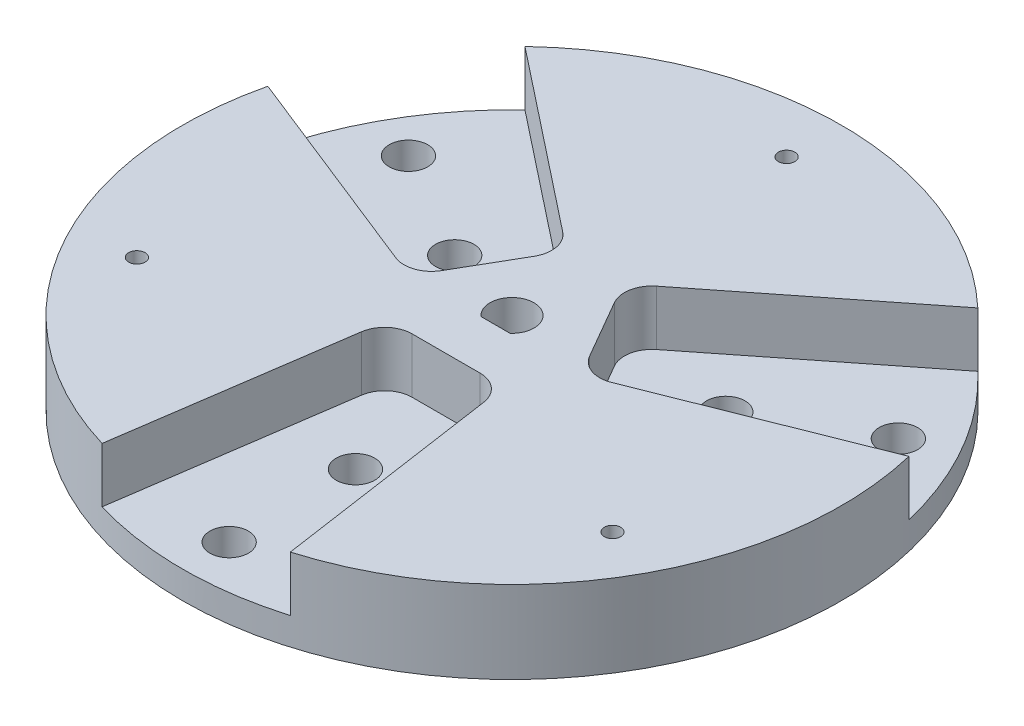
from build123d import *

# Parameters (mm, degrees)
SKETCH1_R           = 60
BOSS_EXTRUDE1_DEPTH = 15
CUT_EXTRUDE1_REACH  = 88.168
CUT_EXTRUDE2_DEPTH  = 10
CUT_EXTRUDE3_REACH  = 87.44
SKETCH3_R           = 3.5
CIRPATTERN1_COUNT   = 3
CIRPATTERN2_COUNT   = 3
FILLET1_R           = 5
CUT_EXTRUDE4_REACH  = 88.168
SKETCH4_R           = 1.5
CIRPATTERN3_COUNT   = 3
BOSS_EXTRUDE2_REACH = 88.168


with BuildPart() as part:
    # Sketch1 → Boss-Extrude1 (new body)
    with BuildSketch(Plane(origin=(0, 0, 0), x_dir=(1, 0, 0), z_dir=(0, 1, 0))):
        Circle(SKETCH1_R)
    extrude(amount=BOSS_EXTRUDE1_DEPTH)

    # Sketch2 → Cut-Extrude1 (cut, up to next)
    with BuildSketch(Plane(origin=(0, 15, 0), x_dir=(1, 0, 0), z_dir=(0, 1, 0)), mode=Mode.PRIVATE) as cut_extrude1_sk1:
        with BuildLine():
            ThreePointArc((2.645751311, -3), (0, 4), (-2.645751311, -3))
            Line((-2.645751311, -3), (2.645751311, -3))
        make_face()
    cut_extrude1_tool1 = extrude(cut_extrude1_sk1.sketch, amount=-CUT_EXTRUDE1_REACH, mode=Mode.PRIVATE) & part.part
    add(cut_extrude1_tool1.solids().sort_by_distance((0, 15, -0.264732))[0], mode=Mode.SUBTRACT)

    # Sketch2<3> → Cut-Extrude2 (cut)
    with BuildSketch(Plane(origin=(0, 15, 0), x_dir=(1, 0, 0), z_dir=(0, 1, 0))):
        with BuildLine():
            Line((-2.645751311, -3), (2.645751311, -3))
            ThreePointArc((2.645751311, -3), (0, 4), (-2.645751311, -3))
        make_face()
        Polygon((-17.5, -60), (17.5, -60), (10.5, -12), (-10.5, -12), align=None)
    cut_extrude2 = extrude(amount=-CUT_EXTRUDE2_DEPTH, mode=Mode.SUBTRACT)

    # Sketch3 → Cut-Extrude3 (cut, up to next)
    with BuildSketch(Plane(origin=(0, 5, 0), x_dir=(1, 0, 0), z_dir=(0, 1, 0)), mode=Mode.PRIVATE) as cut_extrude3_sk1:
        with Locations((0, -28.5)):
            Circle(SKETCH3_R)
    cut_extrude3_tool1 = extrude(cut_extrude3_sk1.sketch, amount=-CUT_EXTRUDE3_REACH, mode=Mode.PRIVATE) & part.part
    # Sketch3 → Cut-Extrude3 (cut, up to next)
    with BuildSketch(Plane(origin=(0, 5, 0), x_dir=(1, 0, 0), z_dir=(0, 1, 0)), mode=Mode.PRIVATE) as cut_extrude3_sk2:
        with Locations((0, -51.5)):
            Circle(SKETCH3_R)
    cut_extrude3_tool2 = extrude(cut_extrude3_sk2.sketch, amount=-CUT_EXTRUDE3_REACH, mode=Mode.PRIVATE) & part.part
    cut_extrude3_1 = cut_extrude3_tool1.solids().sort_by_distance((0, 5, 28.5))[0]
    add(cut_extrude3_1, mode=Mode.SUBTRACT)
    cut_extrude3_2 = cut_extrude3_tool2.solids().sort_by_distance((0, 5, 51.5))[0]
    add(cut_extrude3_2, mode=Mode.SUBTRACT)
    cut_extrude3 = cut_extrude3_1 + cut_extrude3_2  # Cut-Extrude3 as one shape, for the pattern or mirror that repeats it

    # CirPattern1: Cut-Extrude2 ×3 about axis
    cirpattern1_axis = Axis((0, -0.001, 0), (0, 1, 0))
    for i in range(1, CIRPATTERN1_COUNT):
        add(cut_extrude2.rotate(cirpattern1_axis, i * 360 / CIRPATTERN1_COUNT), mode=Mode.SUBTRACT)

    # CirPattern2: Cut-Extrude3 ×3 about axis
    cirpattern2_axis = Axis((0, 15, 0), (0, 1, 0))
    for i in range(1, CIRPATTERN2_COUNT):
        add(cut_extrude3.rotate(cirpattern2_axis, i * 360 / CIRPATTERN2_COUNT), mode=Mode.SUBTRACT)

    # Fillet1
    fillet1_edges = [part.edges().sort_by_distance(p)[0] for p in [
        (10.5, 10, 12),
        (-10.5, 10, 12),
        (-15.642304845, 10, 3.09326674),
        (-5.142304845, 10, -15.09326674),
        (15.642304845, 10, 3.09326674),
        (5.142304845, 10, -15.09326674),
    ]]
    fillet(fillet1_edges, radius=FILLET1_R)

    # Sketch4 → Cut-Extrude4 (cut, up to next)
    with BuildSketch(Plane(origin=(0, 15, 0), x_dir=(1, 0, 0), z_dir=(0, 1, 0)), mode=Mode.PRIVATE) as cut_extrude4_sk1:
        with Locations((0, 50)):
            Circle(SKETCH4_R)
    cut_extrude4_tool1 = extrude(cut_extrude4_sk1.sketch, amount=-CUT_EXTRUDE4_REACH, mode=Mode.PRIVATE) & part.part
    cut_extrude4 = cut_extrude4_tool1.solids().sort_by_distance((0, 15, -50))[0]
    add(cut_extrude4, mode=Mode.SUBTRACT)

    # CirPattern3: Cut-Extrude4 ×3 about axis
    cirpattern3_axis = Axis((0, -0.001, 0), (0, 1, 0))
    for i in range(1, CIRPATTERN3_COUNT):
        add(cut_extrude4.rotate(cirpattern3_axis, i * 360 / CIRPATTERN3_COUNT), mode=Mode.SUBTRACT)

    # Sketch5 → Boss-Extrude2 (add, up to next)
    with BuildSketch(Plane(origin=(0, 15, 0), x_dir=(1, 0, 0), z_dir=(0, 1, 0)), mode=Mode.PRIVATE) as boss_extrude2_sk1:
        with BuildLine():
            Line((-2.645751311, -3), (2.645751311, -3))
            ThreePointArc((2.645751311, -3), (0, -4), (-2.645751311, -3))
        make_face()
    boss_extrude2_tool1 = extrude(boss_extrude2_sk1.sketch, amount=-BOSS_EXTRUDE2_REACH, mode=Mode.PRIVATE) - part.part
    add(boss_extrude2_tool1.solids().sort_by_distance((0, 15, 3.404621))[0])


solid = part.part
